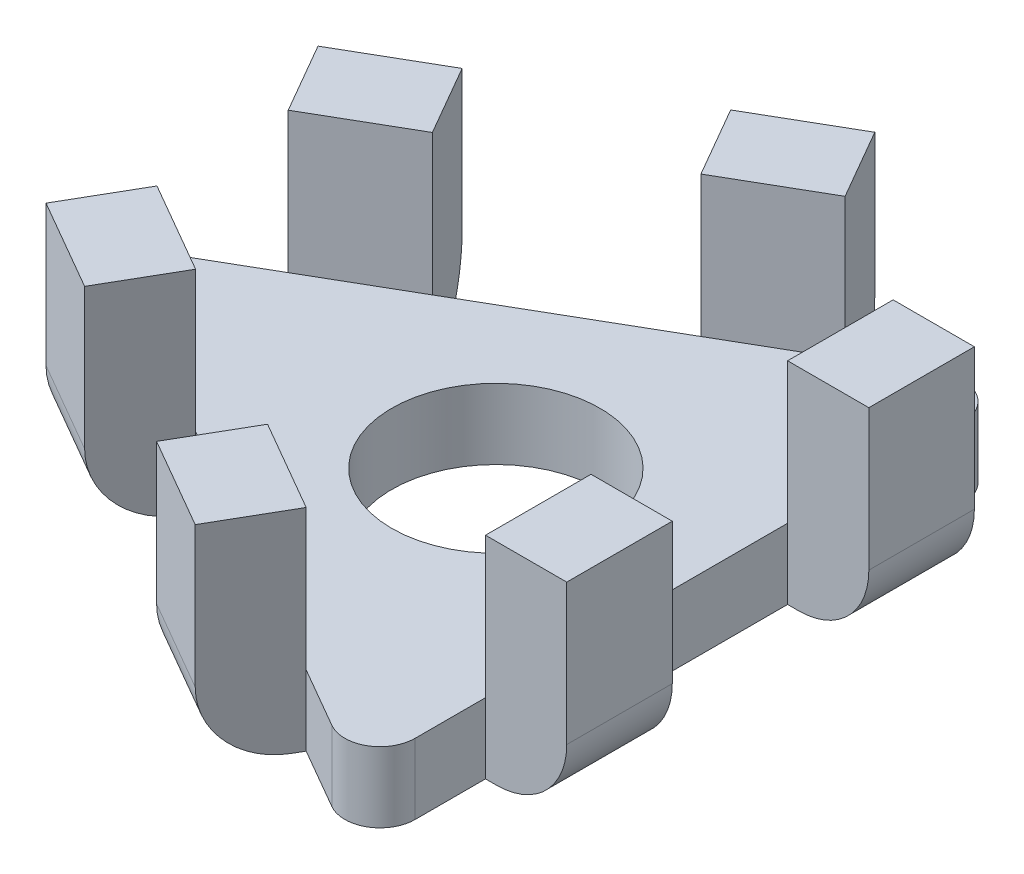
from build123d import *

# Parameters (mm, degrees)
SKETCH2_R           = 14.798837294
BOSS_EXTRUDE1_DEPTH = 10
SKETCH2_7_W         = 15
SKETCH2_7_H         = 11.547005384
BOSS_EXTRUDE3_DEPTH = 30
FILLET1_R           = 10


with BuildPart() as part:
    # Sketch2 → Boss-Extrude1 (new body)
    with BuildSketch(Plane(origin=(0, 0, 0), x_dir=(0, 0, -1), z_dir=(0, 1, 0))):
        with BuildLine():
            Line((-38.301270189, -11.339745962), (-43.301270189, -20))
            ThreePointArc((-43.301270189, -20), (-43.301270189, -25), (-38.97114317, -27.5))
            Line((-38.97114317, -27.5), (-28.97114317, -27.5))
            Line((-28.97114317, -27.5), (-13.97114317, -27.5))
            Line((-13.97114317, -27.5), (13.97114317, -27.5))
            Line((13.97114317, -27.5), (28.97114317, -27.5))
            Line((28.97114317, -27.5), (38.97114317, -27.5))
            ThreePointArc((38.97114317, -27.5), (43.301270189, -25), (43.301270189, -20))
            Line((43.301270189, -20), (38.301270189, -11.339745962))
            Line((38.301270189, -11.339745962), (30.801270189, 1.650635095))
            Line((30.801270189, 1.650635095), (16.830127019, 25.849364905))
            Line((16.830127019, 25.849364905), (9.330127019, 38.839745962))
            Line((9.330127019, 38.839745962), (4.330127019, 47.5))
            ThreePointArc((4.330127019, 47.5), (0, 50), (-4.330127019, 47.5))
            Line((-4.330127019, 47.5), (-9.330127019, 38.839745962))
            Line((-9.330127019, 38.839745962), (-16.830127019, 25.849364905))
            Line((-16.830127019, 25.849364905), (-30.801270189, 1.650635095))
            Line((-30.801270189, 1.650635095), (-38.301270189, -11.339745962))
        make_face()
        Circle(SKETCH2_R, mode=Mode.SUBTRACT)
    extrude(amount=BOSS_EXTRUDE1_DEPTH)

    # Sketch2<7> → Boss-Extrude3 (add)
    with BuildSketch(Plane(origin=(0, 0, 0), x_dir=(0, 0, -1), z_dir=(0, 1, 0))):
        Polygon((-48.301270189, -5.56624327), (-38.301270189, -11.339745962), (-30.801270189, 1.650635095), (-40.801270189, 7.424137787), align=None)
        with Locations((-21.47114317, -33.273502692)):
            Rectangle(SKETCH2_7_W, SKETCH2_7_H)
        Polygon((-26.830127019, 31.622867597), (-16.830127019, 25.849364905), (-9.330127019, 38.839745962), (-19.330127019, 44.613248654), align=None)
        with Locations((21.47114317, -33.273502692)):
            Rectangle(SKETCH2_7_W, SKETCH2_7_H)
        Polygon((19.330127019, 44.613248654), (9.330127019, 38.839745962), (16.830127019, 25.849364905), (26.830127019, 31.622867597), align=None)
        Polygon((30.801270189, 1.650635095), (38.301270189, -11.339745962), (48.301270189, -5.56624327), (40.801270189, 7.424137787), align=None)
    extrude(amount=BOSS_EXTRUDE3_DEPTH)

    # Fillet1
    fillet1_edges = [part.edges().sort_by_distance(p)[0] for p in [
        (39.047005384, 0, -21.47114317),
        (39.047005384, 0, 21.47114317),
        (-0.928947258, 0, 44.551270189),
        (-38.118058126, 0, 23.080127019),
        (-38.118058126, 0, -23.080127019),
        (-0.928947258, 0, -44.551270189),
    ]]
    fillet(fillet1_edges, radius=FILLET1_R)


solid = part.part
